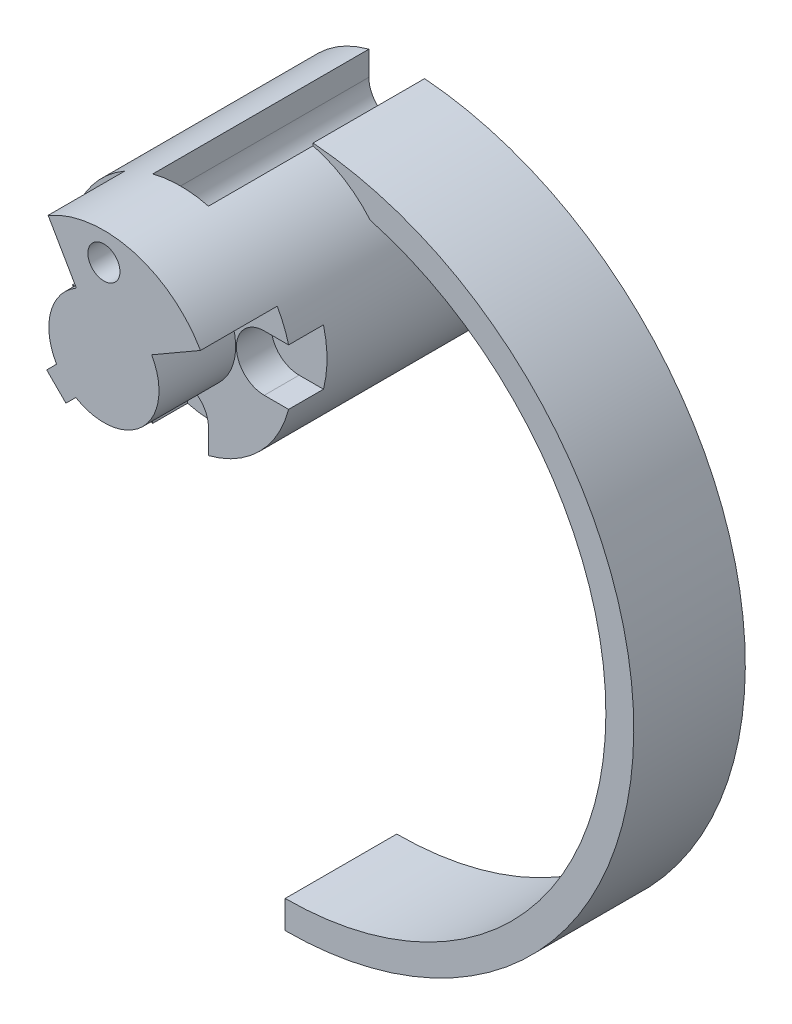
from build123d import *
from build123d.topology import SkipClean

# Parameters (mm, degrees)
SKETCH1_R           = 1.15
BOSS_EXTRUDE1_DEPTH = 8
BOSS_EXTRUDE2_START = 13
SKETCH4_R           = 8
SKETCH4_R_2         = 1.15
BOSS_EXTRUDE2_DEPTH = 13
CUT_EXTRUDE3_DEPTH  = 15.5
CUT_EXTRUDE4_DEPTH  = 5.5
BOSS_EXTRUDE3_START = -13
BOSS_EXTRUDE3_DEPTH = 13


with BuildPart() as part:
    # Sketch1 → Boss-Extrude1 (new body)
    with BuildSketch(Plane.XY):
        with BuildLine():
            Line((0, -42), (0, -40))
            ThreePointArc((0, -40), (22.793187837, -20.077432085), (6.099520657, 5.176470588))
            ThreePointArc((6.099520657, 5.176470588), (7.259881704, -3.360672202), (0, -8))
            ThreePointArc((0, -8), (-8, 0), (0, 8))
            ThreePointArc((0, 8), (25, -17), (0, -42))
        make_face()
        with Locations((0, 6)):
            Circle(SKETCH1_R, mode=Mode.SUBTRACT)
        with Locations((-6, 0)):
            Circle(SKETCH1_R, mode=Mode.SUBTRACT)
        with Locations((0, -6)):
            Circle(SKETCH1_R, mode=Mode.SUBTRACT)
        with Locations((6, 0)):
            Circle(SKETCH1_R, mode=Mode.SUBTRACT)
    extrude(amount=BOSS_EXTRUDE1_DEPTH)

    # Sketch4 → Boss-Extrude2 (add)
    with SkipClean():  # the faces are left unmerged after this step: merging them gives an invalid solid
        with BuildSketch(Plane(origin=(0, 0, 0), x_dir=(-1, 0, 0), z_dir=(0, 0, -1)).offset(BOSS_EXTRUDE2_START)):
            Circle(SKETCH4_R)
            with Locations((0, 6)):
                Circle(SKETCH4_R_2, mode=Mode.SUBTRACT)
            with Locations((-6, 0)):
                Circle(SKETCH4_R_2, mode=Mode.SUBTRACT)
            with Locations((0, -6)):
                Circle(SKETCH4_R_2, mode=Mode.SUBTRACT)
            with Locations((6, 0)):
                Circle(SKETCH4_R_2, mode=Mode.SUBTRACT)
        extrude(amount=-BOSS_EXTRUDE2_DEPTH)

    # Sketch3 → Cut-Extrude3 (cut)
    with BuildSketch(Plane.XY.offset(8)):
        with BuildLine():
            Line((6, 2), (10, 2))
            Line((10, 2), (10, -2))
            Line((10, -2), (6, -2))
            ThreePointArc((6, -2), (4, 0), (6, 2))
        make_face()
        with BuildLine():
            Line((2, -6), (2, -10))
            Line((2, -10), (-2, -10))
            Line((-2, -10), (-2, -6))
            ThreePointArc((-2, -6), (0, -4), (2, -6))
        make_face()
        with BuildLine():
            Line((-6, -2), (-10, -2))
            Line((-10, -2), (-10, 2))
            Line((-10, 2), (-6, 2))
            ThreePointArc((-6, 2), (-4, 0), (-6, -2))
        make_face()
        with BuildLine():
            Line((-2, 6), (-2, 10))
            Line((-2, 10), (2, 10))
            Line((2, 10), (2, 6))
            ThreePointArc((2, 6), (0, 4), (-2, 6))
        make_face()
    extrude(amount=-CUT_EXTRUDE3_DEPTH, mode=Mode.SUBTRACT)

    # Sketch5 → Cut-Extrude4 (cut)
    with BuildSketch(Plane(origin=(0, 0, -13), x_dir=(-1, 0, 0), z_dir=(0, 0, -1))):
        with BuildLine():
            Line((-3.420800345, 1.975), (-6.92820323, 4))
            ThreePointArc((-6.92820323, 4), (2.070552361, -7.72740661), (4, 6.92820323))
            Line((4, 6.92820323), (1.975, 3.420800345))
            ThreePointArc((1.975, 3.420800345), (3.821665179, 0.998686766), (3.396076023, -2.017217799))
            Line((3.396076023, -2.017217799), (4.103182804, -2.72432458))
            Line((4.103182804, -2.72432458), (2.72432458, -4.103182804))
            Line((2.72432458, -4.103182804), (2.017217799, -3.396076023))
            ThreePointArc((2.017217799, -3.396076023), (-2.775720699, -2.810315747), (-3.420800345, 1.975))
        make_face()
    extrude(amount=-CUT_EXTRUDE4_DEPTH, mode=Mode.SUBTRACT)

    # Sketch6 → Boss-Extrude3 (add)
    with BuildSketch(Plane.XY.offset(8).offset(BOSS_EXTRUDE3_START)):
        with BuildLine():
            Line((5.656854249, 5.656854249), (0, 0))
            Line((0, 0), (-5.656854249, 5.656854249))
            ThreePointArc((-5.656854249, 5.656854249), (0, -8), (5.656854249, 5.656854249))
        make_face()
    extrude(amount=BOSS_EXTRUDE3_DEPTH)


with BuildPart() as body_2:
    # Mirror2: mirrored copy
    add(part.part.mirror(Plane.XY))


solid = body_2.part
